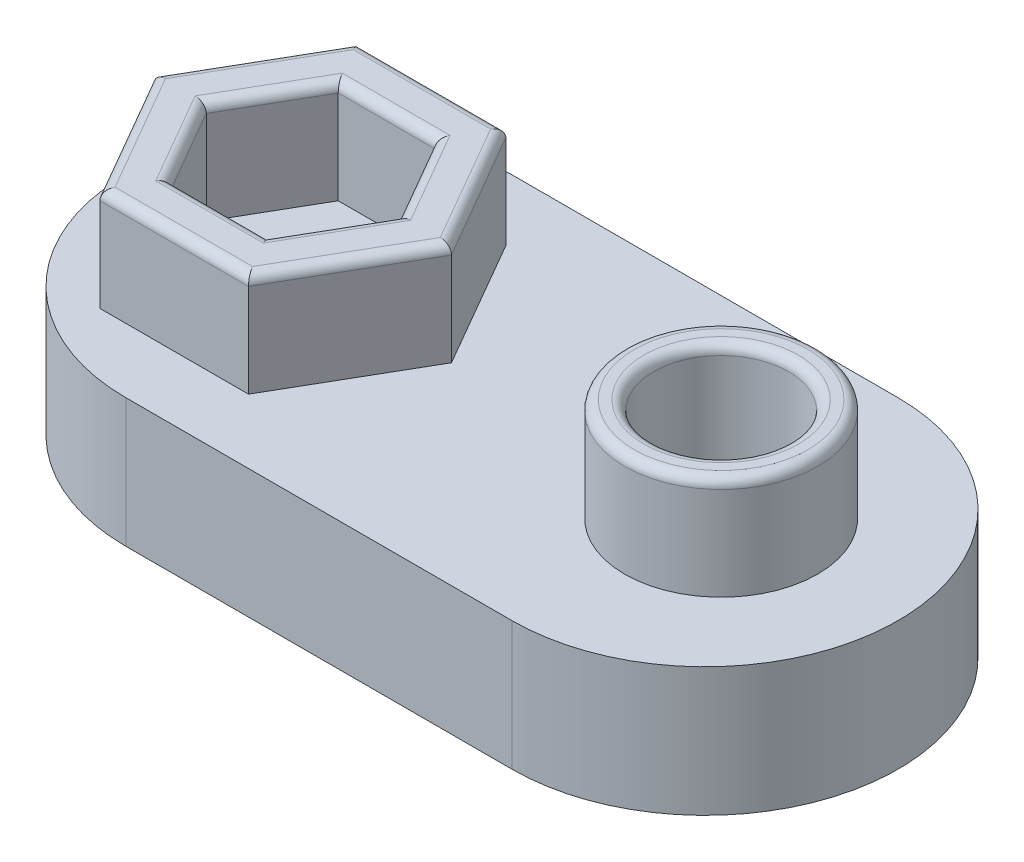
from build123d import *

# Parameters (mm, degrees)
EXTRUDE_1_DEPTH = 4
SKETCH_2_R      = 3
SKETCH_2_R_2    = 2.1
EXTRUDE_2_DEPTH = 3.2
FILLET_1_R      = 0.3


with BuildPart() as part:
    # Эскиз1 → Бобышка-Вытянуть1 (new body)
    with BuildSketch(Plane(origin=(0, 0, 0), x_dir=(1, 0, 0), z_dir=(0, 1, 0))):
        with BuildLine():
            Line((6, 6), (-6, 6))
            ThreePointArc((-6, 6), (-12, 0), (-6, -6))
            Line((-6, -6), (6, -6))
            ThreePointArc((6, -6), (12, 0), (6, 6))
        make_face()
    extrude(amount=EXTRUDE_1_DEPTH)

    # Эскиз2 → Бобышка-Вытянуть2 (add)
    # profile 1 of 2: a face of its own
    with BuildSketch(Plane(origin=(0, 4, 0), x_dir=(1, 0, 0), z_dir=(0, 1, 0))):
        with Locations(Location((6.5, 0, 0), (0, 0, 90))):
            Circle(SKETCH_2_R)
        with Locations(Location((6.5, 0, 0), (0, 0, 270))):
            Circle(SKETCH_2_R_2, mode=Mode.SUBTRACT)
    # profile 2 of 2: a face of its own
    with BuildSketch(Plane(origin=(0, 4, 0), x_dir=(1, 0, 0), z_dir=(0, 1, 0))):
        Polygon((-1.881197846, 0), (-4.190598923, 4), (-8.809401077, 4), (-11.118802154, 0), (-8.809401077, -4), (-4.190598923, -4), align=None)
        Polygon((-3.4977786, 0), (-4.9988893, 2.6), (-8.0011107, 2.6), (-9.5022214, 0), (-8.0011107, -2.6), (-4.9988893, -2.6), align=None, mode=Mode.SUBTRACT)
    extrude(amount=EXTRUDE_2_DEPTH)

    # Скругление1
    fillet_1_edges = [part.edges().sort_by_distance(p)[0] for p in [
        (6.5, 7.2, 3),
        (6.5, 7.2, -2.1),
        (-3.035898385, 7.2, 2),
        (-3.035898385, 7.2, -2),
        (-6.5, 7.2, -4),
        (-9.964101615, 7.2, -2),
        (-9.964101615, 7.2, 2),
        (-6.5, 7.2, 4),
        (-4.24833395, 7.2, 1.3),
        (-4.24833395, 7.2, -1.3),
        (-6.5, 7.2, -2.6),
        (-8.75166605, 7.2, -1.3),
        (-8.75166605, 7.2, 1.3),
        (-6.5, 7.2, 2.6),
    ]]
    fillet(fillet_1_edges, radius=FILLET_1_R)


solid = part.part
